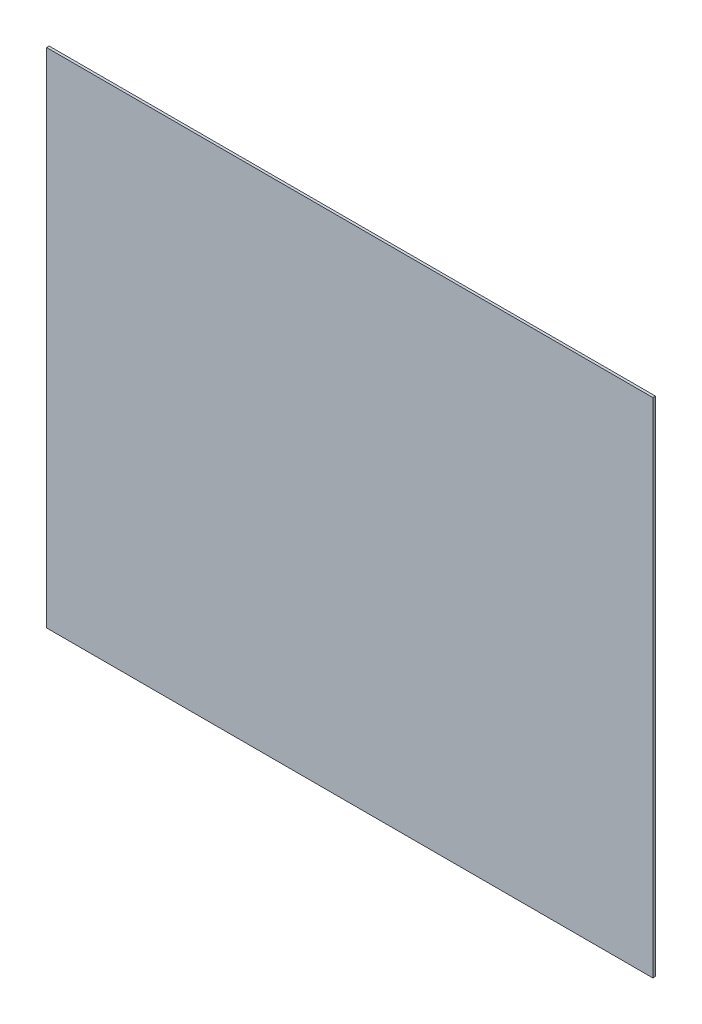
from build123d import *

# Parameters (mm, degrees)
SKETCH1_W           = 742.95
SKETCH1_H           = 615.95
BOSS_EXTRUDE1_DEPTH = 3.175


with BuildPart() as part:
    # Sketch1 → Boss-Extrude1 (new body)
    with BuildSketch(Plane.XY):
        Rectangle(SKETCH1_W, SKETCH1_H)
    extrude(amount=BOSS_EXTRUDE1_DEPTH)


solid = part.part
